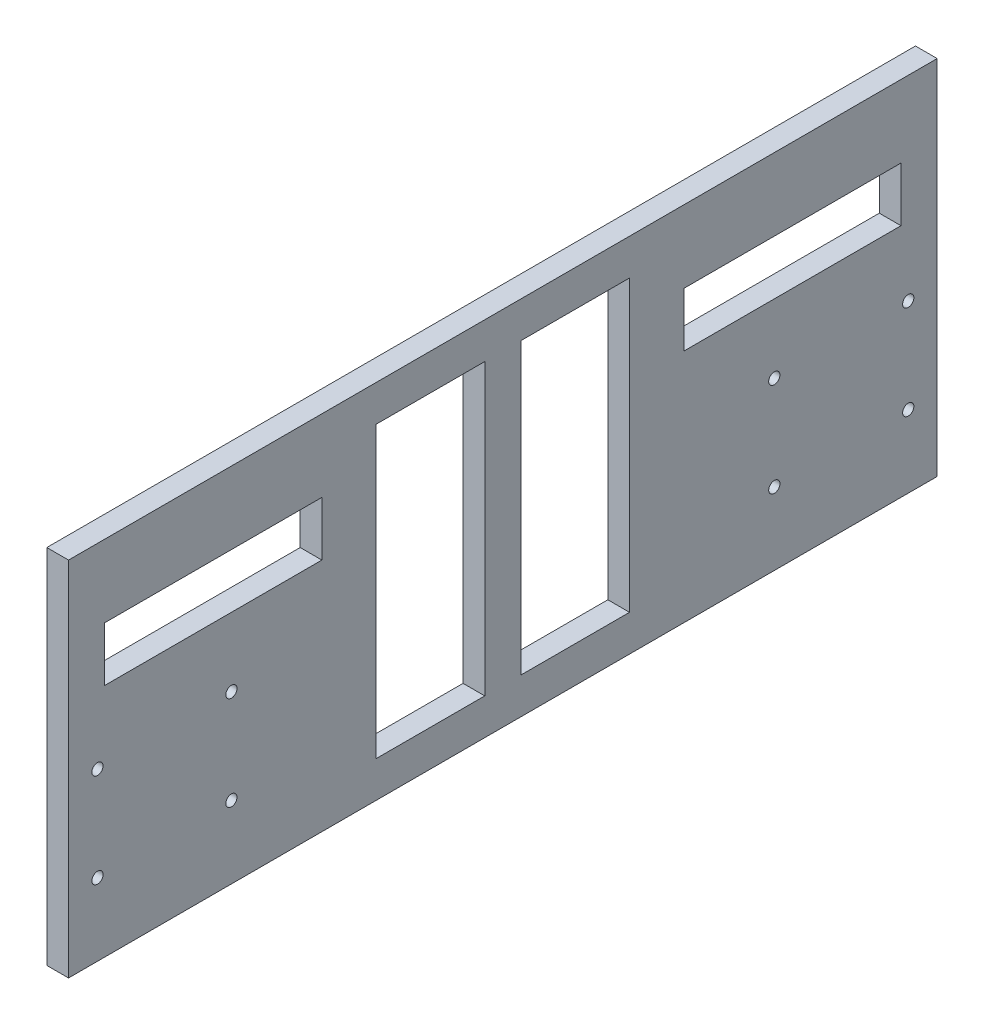
from build123d import *

# Parameters (mm, degrees)
SKETCH_1_W          = 240
SKETCH_1_H          = 100
EXTRUDE_1_DEPTH     = 6
SKETCH_2_R          = 1.55
CUT_EXTRUDE_1_DEPTH = 261.069221555
SKETCH_3_W          = 60
SKETCH_3_H          = 15
CUT_EXTRUDE_2_DEPTH = 261.069221555
SKETCH_4_W          = 30
SKETCH_4_H          = 80
CUT_EXTRUDE_3_DEPTH = 261.069221555
SKETCH_5_R          = 3
CUT_EXTRUDE_4_DEPTH = 3


with BuildPart() as part:
    # 草图1 → 凸台-拉伸1 (new body)
    with BuildSketch(Plane(origin=(0, 0, 0), x_dir=(0, 0, -1), z_dir=(1, 0, 0))):
        with Locations((120, -50)):
            Rectangle(SKETCH_1_W, SKETCH_1_H)
    extrude(amount=EXTRUDE_1_DEPTH)

    # 草图2 → 切除-拉伸1 (cut, through all)
    with BuildSketch(Plane(origin=(6, 0, 0), x_dir=(0, 0, -1), z_dir=(1, 0, 0))):
        with Locations((8, -54)):
            Circle(SKETCH_2_R)
        with Locations((45, -80)):
            Circle(SKETCH_2_R)
        with Locations((45, -54)):
            Circle(SKETCH_2_R)
        with Locations((8, -80)):
            Circle(SKETCH_2_R)
        with Locations(Location((232, -80, 0), (0, 0, 180))):
            Circle(SKETCH_2_R)
        with Locations(Location((195, -54, 0), (0, 0, 180))):
            Circle(SKETCH_2_R)
        with Locations(Location((195, -80, 0), (0, 0, 180))):
            Circle(SKETCH_2_R)
        with Locations(Location((232, -54, 0), (0, 0, 180))):
            Circle(SKETCH_2_R)
    extrude(amount=-CUT_EXTRUDE_1_DEPTH, mode=Mode.SUBTRACT)

    # 草图3 → 切除-拉伸2 (cut, through all)
    with BuildSketch(Plane(origin=(6, 0, 0), x_dir=(0, 0, -1), z_dir=(1, 0, 0))):
        with Locations((40, -27.5)):
            Rectangle(SKETCH_3_W, SKETCH_3_H)
        with Locations((200, -27.5)):
            Rectangle(SKETCH_3_W, SKETCH_3_H)
    extrude(amount=-CUT_EXTRUDE_2_DEPTH, mode=Mode.SUBTRACT)

    # 草图4 → 切除-拉伸3 (cut, through all)
    with BuildSketch(Plane(origin=(6, 0, 0), x_dir=(0, 0, -1), z_dir=(1, 0, 0))):
        with Locations((100, -50)):
            Rectangle(SKETCH_4_W, SKETCH_4_H)
        with Locations((140, -50)):
            Rectangle(SKETCH_4_W, SKETCH_4_H)
    extrude(amount=-CUT_EXTRUDE_3_DEPTH, mode=Mode.SUBTRACT)

    # 草图5 → 切除-拉伸4 (cut)
    with BuildSketch(Plane.ZY):
        with Locations((-195, -80)):
            Circle(SKETCH_5_R)
        with Locations((-232, -80)):
            Circle(SKETCH_5_R)
        with Locations((-195, -54)):
            Circle(SKETCH_5_R)
        with Locations((-232, -54)):
            Circle(SKETCH_5_R)
        with Locations((-45, -80)):
            Circle(SKETCH_5_R)
        with Locations((-8, -80)):
            Circle(SKETCH_5_R)
        with Locations((-8, -54)):
            Circle(SKETCH_5_R)
        with Locations((-45, -54)):
            Circle(SKETCH_5_R)
    extrude(amount=-CUT_EXTRUDE_4_DEPTH, mode=Mode.SUBTRACT)


solid = part.part
